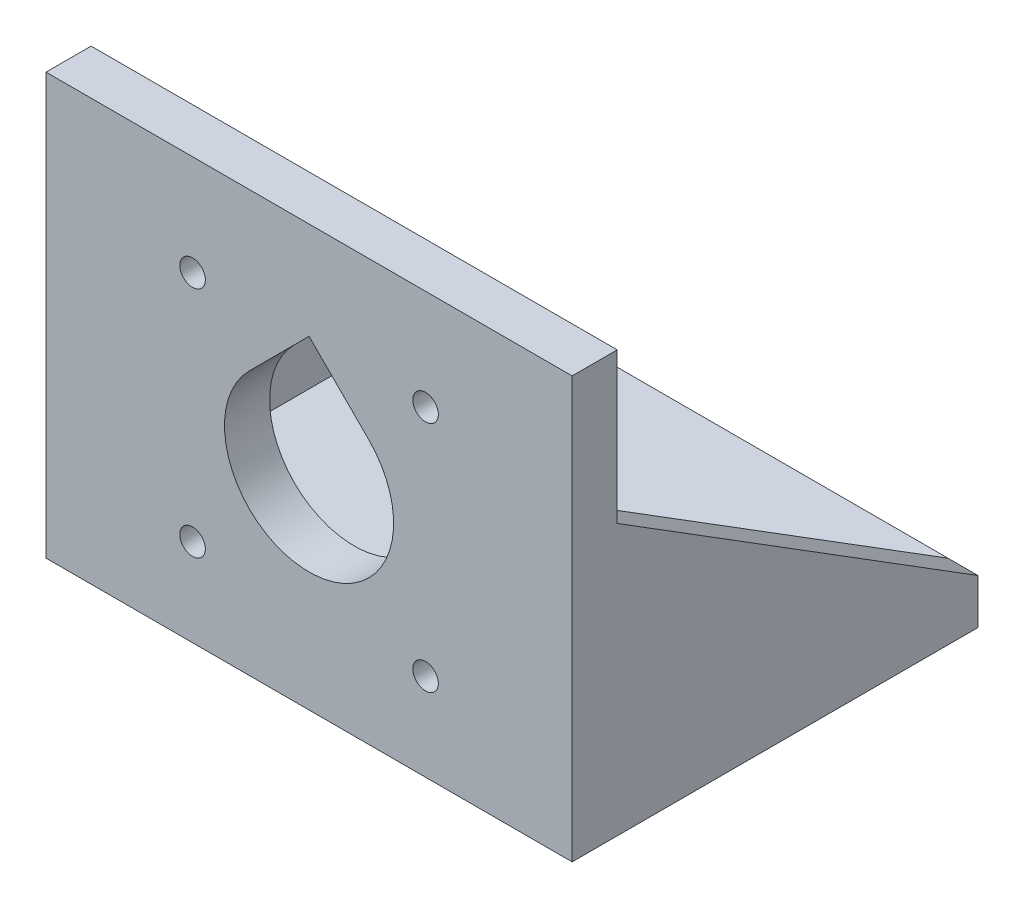
from build123d import *

# Parameters (mm, degrees)
SKETCH_01_W                   = 70
SKETCH_01_H                   = 56
EXTRUDE_01_DEPTH              = 6
SKETCH_02_W                   = 70
SKETCH_02_H                   = 54
EXTRUDE_02_DEPTH              = 6
EXTRUDE_03_DEPTH              = 4
EXTRUDE_START                 = 66
EXTRUDE_04_DEPTH              = 4
CUT_EXTRUDE_05_4_3_DEPTH      = 102.685790551
CUT_EXTRUDE_05_4_3_DEPTH_BACK = 102.685790551
SKETCH_05_R                   = 11.25
SKETCH_05_R_2                 = 1.7
CUT_EXTRUDE_06_DEPTH          = 102.685790551
CUT_EXTRUDE_06_DEPTH_BACK     = 102.685790551
CUT_EXTRUDE_07_4_4_DEPTH      = 102.685790551
CUT_EXTRUDE_07_4_4_DEPTH_BACK = 102.685790551
SKETCH_07_R                   = 2.25


with BuildPart() as part:
    # 01_Пластина_эскиз → 01_Передняя_пластина (new body)
    with BuildSketch(Plane.XY):
        with Locations((35, 28)):
            Rectangle(SKETCH_01_W, SKETCH_01_H)
    extrude(amount=EXTRUDE_01_DEPTH)

    # 02_Полка_эскиз → 02_Полка (add)
    with BuildSketch(Plane(origin=(0, 0, 0), x_dir=(1, 0, 0), z_dir=(0, 1, 0))):
        with Locations((35, 21)):
            Rectangle(SKETCH_02_W, SKETCH_02_H)
    extrude(amount=EXTRUDE_02_DEPTH)

    # 03_Косынка_левая_эскиз → 03_Косынка_левая (add)
    with BuildSketch(Plane(origin=(0, 0, 0), x_dir=(0, 0, -1), z_dir=(1, 0, 0))):
        Polygon((48, 6), (0, 6), (0, 36), align=None)
    extrude(amount=EXTRUDE_03_DEPTH)

    # 04_Косынка_правая_эскиз → 04_Косынка_правая (add)
    with BuildSketch(Plane(origin=(0, 0, 0), x_dir=(0, 0, -1), z_dir=(1, 0, 0)).offset(EXTRUDE_START)):
        Polygon((48, 6), (0, 6), (0, 36), align=None)
    extrude(amount=EXTRUDE_04_DEPTH)

    # 05_Мотор_передний_фланец_эскиз → 05_Буртик_и_4_отверстия_М3 (cut, two sides: drawn at the far end of the back side and taken through both)
    with BuildSketch(Plane.XY.offset(-CUT_EXTRUDE_05_4_3_DEPTH_BACK)):
        with Locations((35, 27.15)):
            Circle(SKETCH_05_R)
        with Locations((19.5, 11.65)):
            Circle(SKETCH_05_R_2)
        with Locations((19.5, 42.65)):
            Circle(SKETCH_05_R_2)
        with Locations((50.5, 11.65)):
            Circle(SKETCH_05_R_2)
        with Locations((50.5, 42.65)):
            Circle(SKETCH_05_R_2)
    extrude(amount=CUT_EXTRUDE_05_4_3_DEPTH + CUT_EXTRUDE_05_4_3_DEPTH_BACK, mode=Mode.SUBTRACT)

    # 06_Свод_45град_эскиз → 06_Свод_отверстия_для_печати (cut, two sides: drawn at the far end of the back side and taken through both)
    with BuildSketch(Plane.XY.offset(-CUT_EXTRUDE_06_DEPTH_BACK)):
        Polygon((27.045048712, 35.104951288), (42.954951288, 35.104951288), (35, 43.059902577), align=None)
    extrude(amount=CUT_EXTRUDE_06_DEPTH + CUT_EXTRUDE_06_DEPTH_BACK, mode=Mode.SUBTRACT)

    # 07_Крепление_полки_эскиз → 07_4_отверстия_М4 (cut, two sides: drawn at the far end of the back side and taken through both)
    with BuildSketch(Plane(origin=(0, 0, 0), x_dir=(1, 0, 0), z_dir=(0, 1, 0)).offset(-CUT_EXTRUDE_07_4_4_DEPTH_BACK)):
        with Locations(Location((8.5, 12, 0), (0, 0, 270))):
            Circle(SKETCH_07_R)
        with Locations(Location((8.5, 38, 0), (0, 0, 270))):
            Circle(SKETCH_07_R)
        with Locations(Location((61.5, 12, 0), (0, 0, 270))):
            Circle(SKETCH_07_R)
        with Locations(Location((61.5, 38, 0), (0, 0, 270))):
            Circle(SKETCH_07_R)
    extrude(amount=CUT_EXTRUDE_07_4_4_DEPTH + CUT_EXTRUDE_07_4_4_DEPTH_BACK, mode=Mode.SUBTRACT)


solid = part.part
